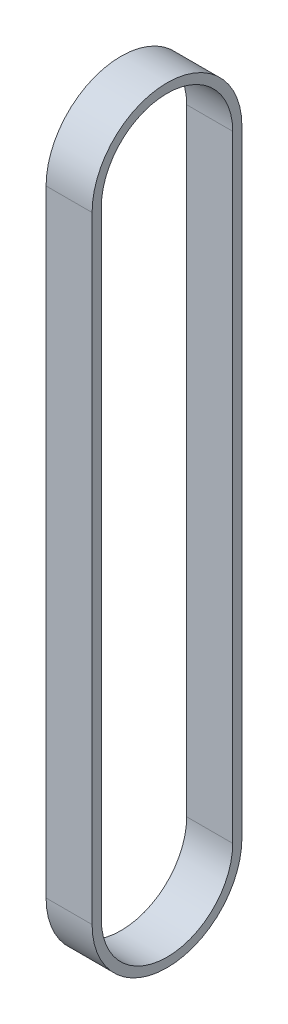
from build123d import *

# Parameters (mm, degrees)
BOSS_EXTRUDE1_DEPTH = 3.175


with BuildPart() as part:
    # Sketch1 → Boss-Extrude1 (new body)
    with BuildSketch(Plane(origin=(0, 0, 0), x_dir=(0, 0, -1), z_dir=(1, 0, 0))):
        with BuildLine():
            Line((5.1689, 0), (5.1689, -42.545))
            ThreePointArc((5.1689, -42.545), (0, -47.7139), (-5.1689, -42.545))
            Line((-5.1689, -42.545), (-5.1689, 0))
            ThreePointArc((-5.1689, 0), (0, 5.1689), (5.1689, 0))
        make_face()
        with BuildLine():
            Line((4.5339, 0), (4.5339, -42.545))
            ThreePointArc((4.5339, -42.545), (0, -47.0789), (-4.5339, -42.545))
            Line((-4.5339, -42.545), (-4.5339, 0))
            ThreePointArc((-4.5339, 0), (0, 4.5339), (4.5339, 0))
        make_face(mode=Mode.SUBTRACT)
    extrude(amount=BOSS_EXTRUDE1_DEPTH)


solid = part.part
